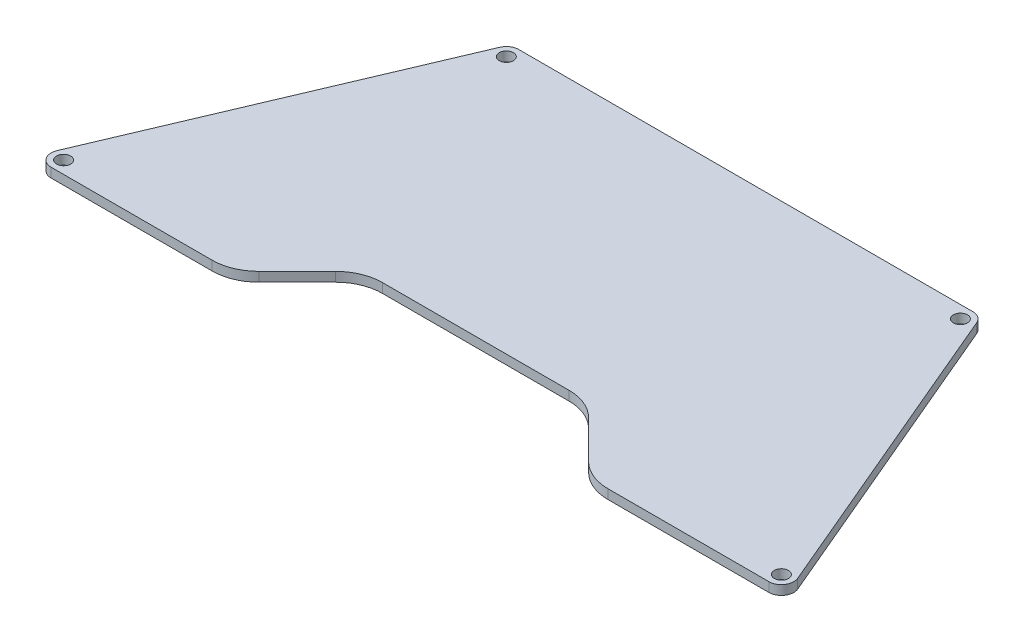
from build123d import *

# Parameters (mm, degrees)
SKETCH_1_R      = 1.5
EXTRUDE_1_DEPTH = 2
FILLET_1_R      = 10
FILLET_2_R      = 10
FILLET_3_R      = 10
FILLET_4_R      = 10


with BuildPart() as part:
    # 草图1 → 凸台-拉伸1 (new body)
    with BuildSketch(Plane(origin=(0, 0, 0), x_dir=(1, 0, 0), z_dir=(0, 1, 0))):
        with BuildLine():
            Line((-2.439592735, 1.034836841), (25.627407265, 67.201836841))
            ThreePointArc((25.627407265, 67.201836841), (26.60409495, 68.376617346), (28.067, 68.817))
            Line((28.067, 68.817), (124.714, 68.817))
            ThreePointArc((124.714, 68.817), (126.17690505, 68.376617346), (127.153592735, 67.201836841))
            Line((127.153592735, 67.201836841), (155.220592735, 1.034836841))
            ThreePointArc((155.220592735, 1.034836841), (154.990617346, -1.46290505), (152.781, -2.65))
            Line((152.781, -2.65), (114.3905, -2.65))
            Line((114.3905, -2.65), (100.3905, 11.35))
            Line((100.3905, 11.35), (52.3905, 11.35))
            Line((52.3905, 11.35), (38.3905, -2.65))
            Line((38.3905, -2.65), (0, -2.65))
            ThreePointArc((0, -2.65), (-2.209617346, -1.46290505), (-2.439592735, 1.034836841))
        make_face()
        with Locations(Location((0, 0, 0), (0, 0, 270))):
            Circle(SKETCH_1_R, mode=Mode.SUBTRACT)
        with Locations(Location((152.781, 0, 0), (0, 0, 270))):
            Circle(SKETCH_1_R, mode=Mode.SUBTRACT)
        with Locations(Location((28.067, 66.167, 0), (0, 0, 270))):
            Circle(SKETCH_1_R, mode=Mode.SUBTRACT)
        with Locations(Location((124.714, 66.167, 0), (0, 0, 90))):
            Circle(SKETCH_1_R, mode=Mode.SUBTRACT)
    extrude(amount=EXTRUDE_1_DEPTH)

    # 圆角1
    fillet_1_edges = [part.edges().sort_by_distance(p)[0] for p in [
        (38.3905, 1, 2.65),
    ]]
    fillet(fillet_1_edges, radius=FILLET_1_R)

    # 圆角2
    fillet_2_edges = [part.edges().sort_by_distance(p)[0] for p in [
        (52.3905, 1, -11.35),
    ]]
    fillet(fillet_2_edges, radius=FILLET_2_R)

    # 圆角3
    fillet_3_edges = [part.edges().sort_by_distance(p)[0] for p in [
        (100.3905, 1, -11.35),
    ]]
    fillet(fillet_3_edges, radius=FILLET_3_R)

    # 圆角4
    fillet_4_edges = [part.edges().sort_by_distance(p)[0] for p in [
        (114.3905, 1, 2.65),
    ]]
    fillet(fillet_4_edges, radius=FILLET_4_R)


solid = part.part
